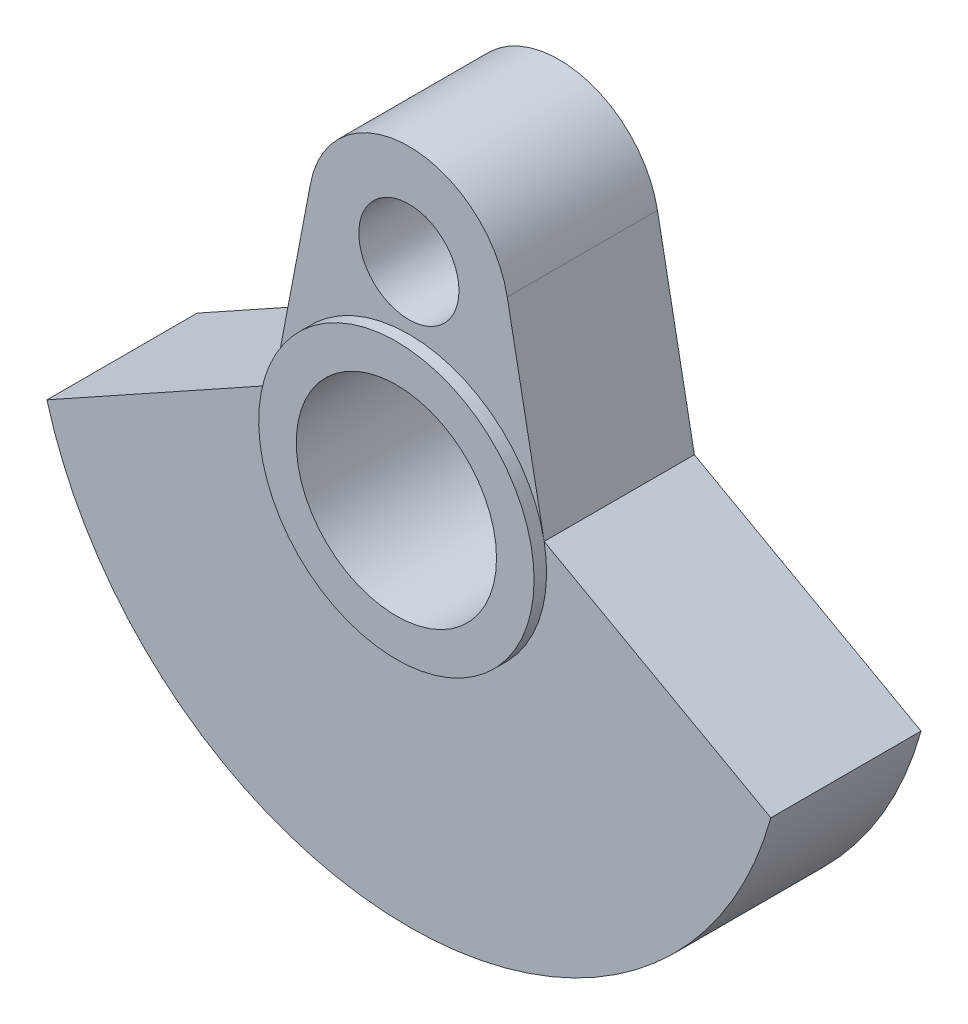
from build123d import *

# Parameters (mm, degrees)
SKETCH1_R           = 2
SKETCH1_R_2         = 4
BOSS_EXTRUDE1_DEPTH = 6
SKETCH2_R           = 5.5
BOSS_EXTRUDE2_DEPTH = 0.5
CUT_EXTRUDE1_START  = -10.5
SKETCH3_R           = 4
CUT_EXTRUDE1_DEPTH  = 10.5


with BuildPart() as part:
    # Sketch1 → Boss-Extrude1 (new body)
    with BuildSketch(Plane.XY):
        with BuildLine():
            Line((-5.402455316, -6.96875), (-3.929058411, 0.75))
            ThreePointArc((-3.929058411, 0.75), (0, 4), (3.929058411, 0.75))
            Line((3.929058411, 0.75), (5.402455316, -6.96875))
            Line((5.402455316, -6.96875), (14.456832295, -12))
            ThreePointArc((14.456832295, -12), (0, -23), (-14.456832295, -12))
            Line((-14.456832295, -12), (-5.402455316, -6.96875))
        make_face()
        Circle(SKETCH1_R, mode=Mode.SUBTRACT)
        with Locations((0, -8)):
            Circle(SKETCH1_R_2, mode=Mode.SUBTRACT)
    extrude(amount=BOSS_EXTRUDE1_DEPTH)

    # Sketch2 → Boss-Extrude2 (add)
    with BuildSketch(Plane.XY.offset(6)):
        with Locations(Location((0, -8, 0), (0, 0, 169.193077125))):
            Circle(SKETCH2_R)
    extrude(amount=BOSS_EXTRUDE2_DEPTH)

    # Sketch3 → Cut-Extrude1 (cut)
    with BuildSketch(Plane.XY.offset(6.5).offset(CUT_EXTRUDE1_START)):
        with Locations((0, -8)):
            Circle(SKETCH3_R)
    extrude(amount=CUT_EXTRUDE1_DEPTH, mode=Mode.SUBTRACT)


solid = part.part
